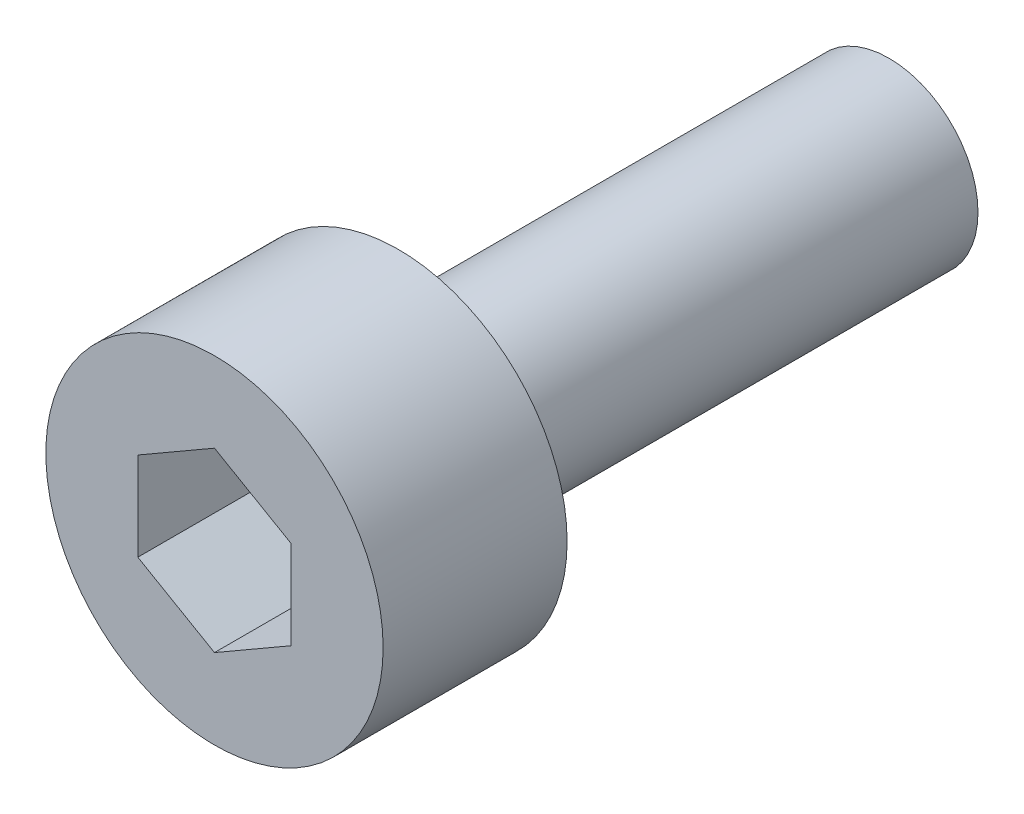
from build123d import *

# Parameters (mm, degrees)
SKETCH_1_R                     = 1.45
SHANK_THREADS_SIMPLIFIED_DEPTH = 8
SKETCH_2_R                     = 2.75
SOCKET_HEAD_DEPTH              = 3
HEX_SOCKET_DEPTH               = 1.95


with BuildPart() as part:
    # 草图1 → Shank_threads_simplified (new body)
    with BuildSketch(Plane.XY):
        Circle(SKETCH_1_R)
    extrude(amount=-SHANK_THREADS_SIMPLIFIED_DEPTH)

    # 草图2 → Socket_head (add)
    with BuildSketch(Plane.XY):
        Circle(SKETCH_2_R)
    extrude(amount=SOCKET_HEAD_DEPTH)

    # 草图3 → Hex_socket (cut)
    with BuildSketch(Plane.XY.offset(3)):
        Polygon((1.25, 0.721687836), (0, 1.443375673), (-1.25, 0.721687836), (-1.25, -0.721687836), (0, -1.443375673), (1.25, -0.721687836), align=None)
    extrude(amount=-HEX_SOCKET_DEPTH, mode=Mode.SUBTRACT)


solid = part.part
